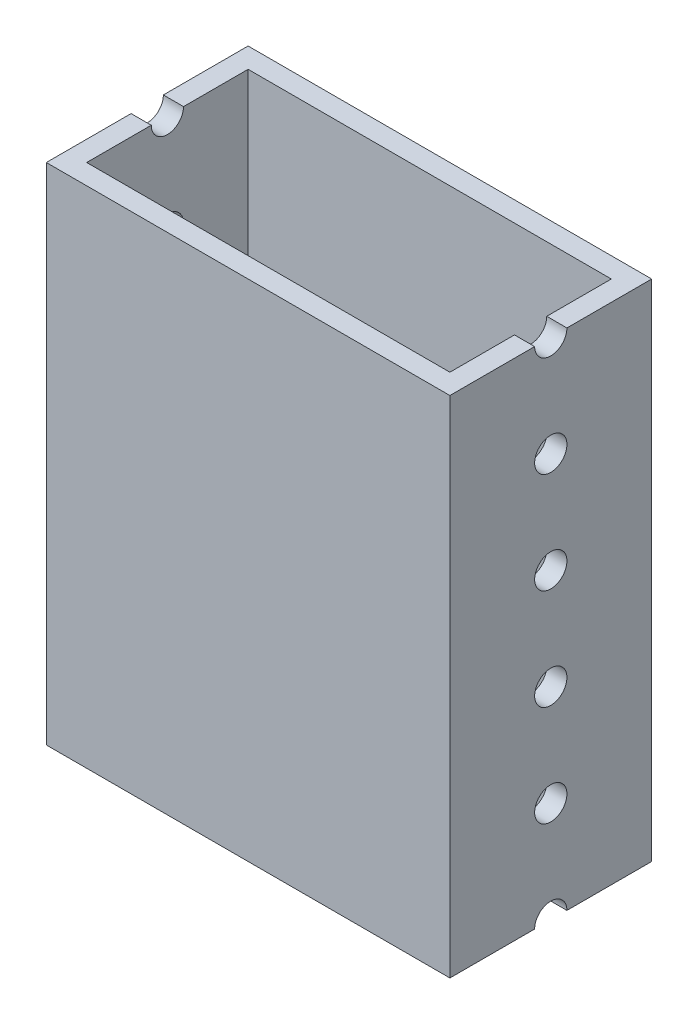
from build123d import *

# Parameters (mm, degrees)
SKETCH2_W           = 50.8
SKETCH2_H           = 25.4
SKETCH2_W_2         = 45.72
SKETCH2_H_2         = 20.32
BOSS_EXTRUDE1_DEPTH = 635
SKETCH3_R           = 2.032
CUT_EXTRUDE1_DEPTH  = 638.155342126
SKETCH6_W           = 50.8
SKETCH6_H           = 25.4
CUT_EXTRUDE4_DEPTH  = 571.5


with BuildPart() as part:
    # Sketch2 → Boss-Extrude1 (new body)
    with BuildSketch(Plane(origin=(0, 0, 0), x_dir=(1, 0, 0), z_dir=(0, 1, 0))):
        Rectangle(SKETCH2_W, SKETCH2_H)
        Rectangle(SKETCH2_W_2, SKETCH2_H_2, mode=Mode.SUBTRACT)
    extrude(amount=BOSS_EXTRUDE1_DEPTH)

    # Sketch3 → Cut-Extrude1 (cut, through all)
    with BuildSketch(Plane(origin=(25.4, 0, 0), x_dir=(0, 0, -1), z_dir=(1, 0, 0))):
        Circle(SKETCH3_R)
        with Locations((0, 12.7)):
            Circle(SKETCH3_R)
        with Locations((0, 25.4)):
            Circle(SKETCH3_R)
        with Locations((0, 38.1)):
            Circle(SKETCH3_R)
        with Locations((0, 50.8)):
            Circle(SKETCH3_R)
        with Locations((0, 63.5)):
            Circle(SKETCH3_R)
        with Locations((0, 76.2)):
            Circle(SKETCH3_R)
        with Locations((0, 88.9)):
            Circle(SKETCH3_R)
        with Locations((0, 101.6)):
            Circle(SKETCH3_R)
        with Locations((0, 114.3)):
            Circle(SKETCH3_R)
        with Locations((0, 127)):
            Circle(SKETCH3_R)
        with Locations((0, 139.7)):
            Circle(SKETCH3_R)
        with Locations((0, 152.4)):
            Circle(SKETCH3_R)
        with Locations((0, 165.1)):
            Circle(SKETCH3_R)
        with Locations((0, 177.8)):
            Circle(SKETCH3_R)
        with Locations((0, 190.5)):
            Circle(SKETCH3_R)
        with Locations((0, 203.2)):
            Circle(SKETCH3_R)
        with Locations((0, 215.9)):
            Circle(SKETCH3_R)
        with Locations((0, 228.6)):
            Circle(SKETCH3_R)
        with Locations((0, 241.3)):
            Circle(SKETCH3_R)
        with Locations((0, 254)):
            Circle(SKETCH3_R)
        with Locations((0, 266.7)):
            Circle(SKETCH3_R)
        with Locations((0, 279.4)):
            Circle(SKETCH3_R)
        with Locations((0, 292.1)):
            Circle(SKETCH3_R)
        with Locations((0, 304.8)):
            Circle(SKETCH3_R)
        with Locations((0, 317.5)):
            Circle(SKETCH3_R)
        with Locations((0, 330.2)):
            Circle(SKETCH3_R)
        with Locations((0, 342.9)):
            Circle(SKETCH3_R)
        with Locations((0, 355.6)):
            Circle(SKETCH3_R)
        with Locations((0, 368.3)):
            Circle(SKETCH3_R)
        with Locations((0, 381)):
            Circle(SKETCH3_R)
        with Locations((0, 393.7)):
            Circle(SKETCH3_R)
        with Locations((0, 406.4)):
            Circle(SKETCH3_R)
        with Locations((0, 419.1)):
            Circle(SKETCH3_R)
        with Locations((0, 431.8)):
            Circle(SKETCH3_R)
        with Locations((0, 444.5)):
            Circle(SKETCH3_R)
        with Locations((0, 457.2)):
            Circle(SKETCH3_R)
        with Locations((0, 469.9)):
            Circle(SKETCH3_R)
        with Locations((0, 482.6)):
            Circle(SKETCH3_R)
        with Locations((0, 495.3)):
            Circle(SKETCH3_R)
        with Locations((0, 508)):
            Circle(SKETCH3_R)
        with Locations((0, 520.7)):
            Circle(SKETCH3_R)
        with Locations((0, 533.4)):
            Circle(SKETCH3_R)
        with Locations((0, 546.1)):
            Circle(SKETCH3_R)
        with Locations((0, 558.8)):
            Circle(SKETCH3_R)
        with Locations((0, 571.5)):
            Circle(SKETCH3_R)
        with Locations((0, 584.2)):
            Circle(SKETCH3_R)
        with Locations((0, 596.9)):
            Circle(SKETCH3_R)
        with Locations((0, 609.6)):
            Circle(SKETCH3_R)
        with Locations((0, 622.3)):
            Circle(SKETCH3_R)
    extrude(amount=-CUT_EXTRUDE1_DEPTH, mode=Mode.SUBTRACT)

    # Sketch6 → Cut-Extrude4 (cut)
    with BuildSketch(Plane(origin=(0, 635, 0), x_dir=(1, 0, 0), z_dir=(0, 1, 0))):
        Rectangle(SKETCH6_W, SKETCH6_H)
    extrude(amount=-CUT_EXTRUDE4_DEPTH, mode=Mode.SUBTRACT)


solid = part.part
